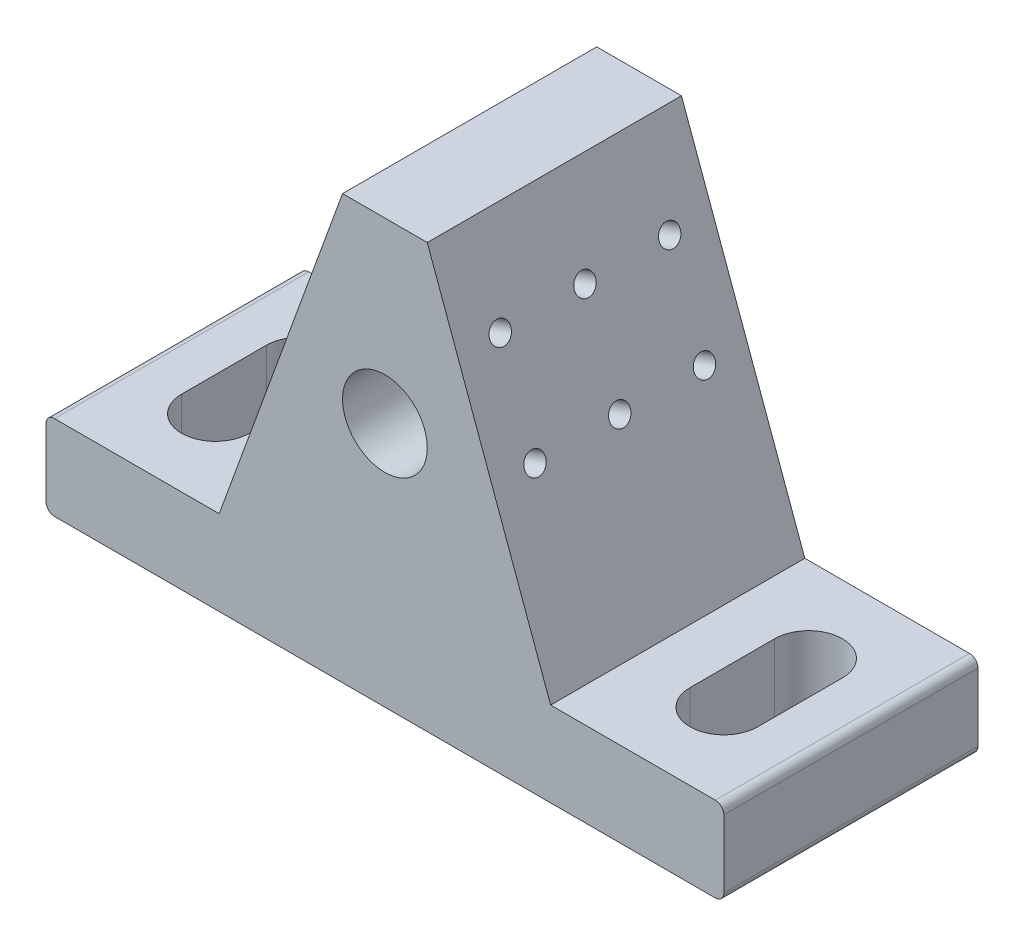
from build123d import *

# Parameters (mm, degrees)
BASE_EXTRUDE_DEPTH   = 15
SLOT_CUT_DEPTH       = 66.76473219
SKETCH5_R            = 5
GUIDE_HOLE_DEPTH     = 71.710678119
LPATTERN1_COUNT      = 3
LPATTERN1_PITCH      = 10
LPATTERN1_COUNT_DIR2 = 2
LPATTERN1_PITCH_DIR2 = 12
FILLET1_R            = 1


with BuildPart() as part:
    # Sketch2 → Base Extrude (new, symmetric)
    with BuildSketch(Plane.XY):
        Polygon((-40, 0), (40, 0), (40, 10), (19.558809371, 10), (5, 50), (-5, 50), (-19.558809371, 10), (-40, 10), align=None)
    extrude(amount=BASE_EXTRUDE_DEPTH, both=True)

    # Sketch4 → Slot Cut (cut, through all)
    with BuildSketch(Plane(origin=(0, 0, 0), x_dir=(1, 0, 0), z_dir=(0, 1, 0))):
        with BuildLine():
            Line((26, -5), (26, 5))
            ThreePointArc((26, 5), (30, 9), (34, 5))
            Line((34, 5), (34, -5))
            ThreePointArc((34, -5), (30, -9), (26, -5))
        make_face()
    slot_cut = extrude(amount=SLOT_CUT_DEPTH, mode=Mode.SUBTRACT)

    # Mirror1: Slot Cut across plane
    add(slot_cut.mirror(Plane(origin=(0, 0, 0), x_dir=(0, 0, 1), z_dir=(1, 0, 0))), mode=Mode.SUBTRACT)

    # Sketch5 → Guide Hole (cut, through all)
    with BuildSketch(Plane.XY.offset(15)):
        with Locations((0, 29)):
            Circle(SKETCH5_R)
    extrude(amount=-GUIDE_HOLE_DEPTH, mode=Mode.SUBTRACT)

    # Sketch10 → M3x0.5 Tapped Hole2 (revolve, cut)
    with BuildSketch(Plane(origin=(12.718406504, 28.793852416, 10), x_dir=(-0.3420201433256662, 0.9396926207859093, 0), z_dir=(0, 0, 1))):
        Polygon((0, 0), (0, 8.251075774), (1.25, 7.5), (1.25, 0), align=None)
    m3x0_5_tapped_hole2 = revolve(axis=Axis((18.685454646, 30.965680326, 10), (-0.9396926207859093, -0.34202014332566616, 0)), mode=Mode.SUBTRACT)

    # LPattern1: M3x0.5 Tapped Hole2 3 × 2
    with Locations(*[Vector(0, 0, -1) * (i * LPATTERN1_PITCH) + Vector(-0.34202014332566616, 0.9396926207859094, 0) * (j * LPATTERN1_PITCH_DIR2) for i in range(LPATTERN1_COUNT) for j in range(LPATTERN1_COUNT_DIR2) if (i, j) != (0, 0)]):
        add(m3x0_5_tapped_hole2, mode=Mode.SUBTRACT)

    # Fillet1
    fillet1_edges = [part.edges().sort_by_distance(p)[0] for p in [
        (40, 0, 0),
        (-40, 0, 0),
        (-40, 10, 0),
        (40, 10, 0),
    ]]
    fillet(fillet1_edges, radius=FILLET1_R)


solid = part.part
